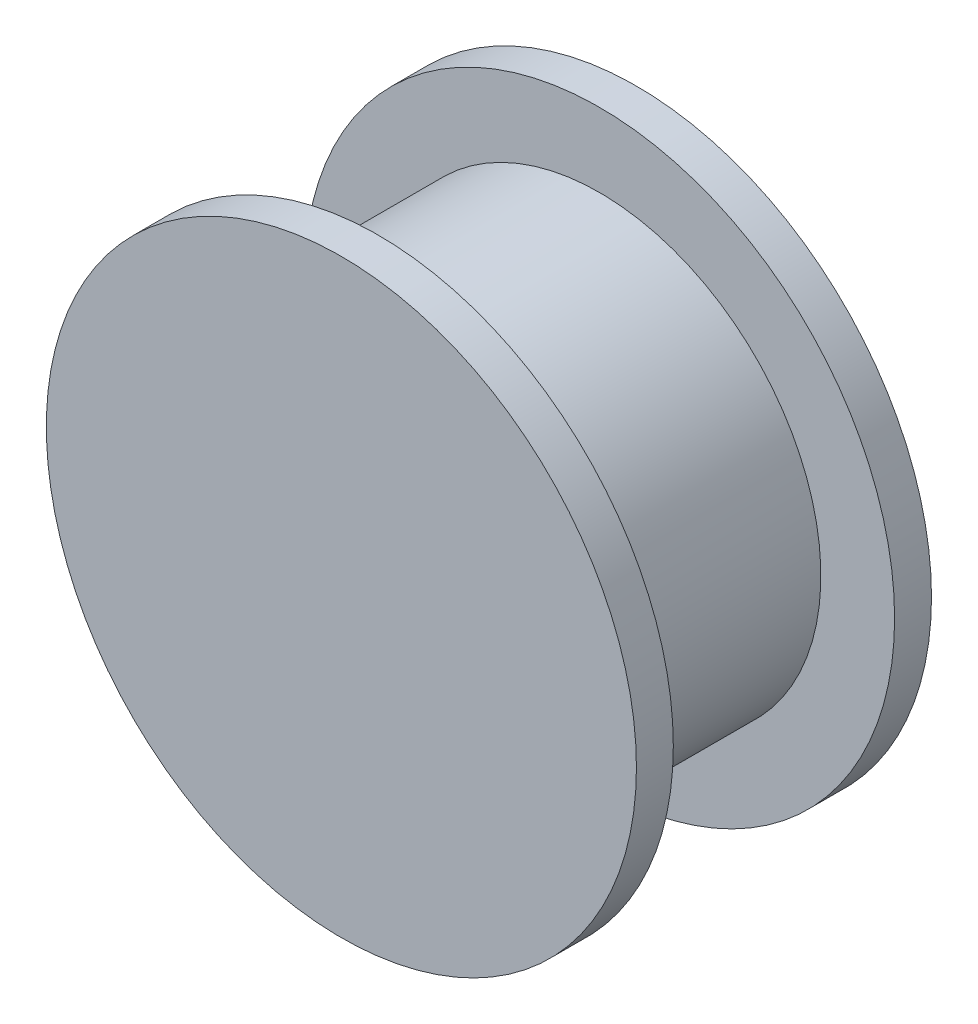
from build123d import *

# Parameters (mm, degrees)
SKETCH1_R           = 25.4
BOSS_EXTRUDE1_DEPTH = 3.175
SKETCH2_R           = 19.05
BOSS_EXTRUDE2_DEPTH = 19.05
SKETCH3_R           = 25.4
BOSS_EXTRUDE3_DEPTH = 3.175


with BuildPart() as part:
    # Sketch1 → Boss-Extrude1 (new body)
    with BuildSketch(Plane.XY):
        Circle(SKETCH1_R)
    extrude(amount=BOSS_EXTRUDE1_DEPTH)

    # Sketch2 → Boss-Extrude2 (add)
    with BuildSketch(Plane.XY.offset(3.175)):
        with Locations(Location((0, 0, 0), (0, 0, 180))):
            Circle(SKETCH2_R)
    extrude(amount=BOSS_EXTRUDE2_DEPTH)

    # Sketch3 → Boss-Extrude3 (add)
    with BuildSketch(Plane.XY.offset(22.225)):
        Circle(SKETCH3_R)
    extrude(amount=BOSS_EXTRUDE3_DEPTH)


solid = part.part
